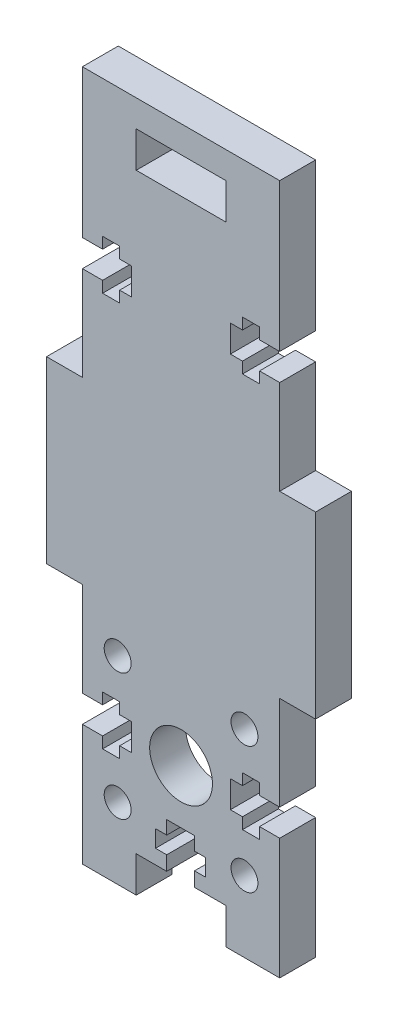
from build123d import *

# Parameters (mm, degrees)
SKETCH1_W                     = 22
SKETCH1_H                     = 74
SKETCH1_R                     = 3.5
SHEET_THICKNESS_DEPTH         = 4
BEARING_START                 = -4
SKETCH2_R                     = 3.5
SKETCH2_R_2                   = 1.5
BEARING_HOLDER_MOUNTING_DEPTH = 4
NUT_MOUNTING_DEPTH            = 4
SKETCH5_W                     = 10
SKETCH5_H                     = 4
TOP_SLOTS_DEPTH               = 4
SKETCH9_W                     = 4
SKETCH9_H                     = 20
BOSS_EXTRUDE3_DEPTH           = 4
SKETCH10_W                    = 4
SKETCH10_H                    = 20
BOSS_EXTRUDE4_DEPTH           = 4
SKETCH11_W                    = 22
SKETCH11_H                    = 4
BOSS_EXTRUDE5_DEPTH           = 3
SKETCH14_W                    = 1.55
SKETCH14_H                    = 1.5
SKETCH14_H_2                  = 1.9
SKETCH14_H_3                  = 1.6
SKETCH14_W_2                  = 1.25
CUT_EXTRUDE4_DEPTH            = 10


with BuildPart() as part:
    # Sketch1 → Sheet Thickness (new body)
    with BuildSketch(Plane.XY):
        with Locations((10, -16)):
            Rectangle(SKETCH1_W, SKETCH1_H)
        with Locations((10, -38)):
            Circle(SKETCH1_R, mode=Mode.SUBTRACT)
    extrude(amount=SHEET_THICKNESS_DEPTH)

    # Sketch2 → Bearing Holder Mounting (cut)
    with BuildSketch(Plane.XY.offset(4).offset(BEARING_START)):
        with Locations((10, -38)):
            Circle(SKETCH2_R)
        with Locations((2.928932188, -30.928932188)):
            Circle(SKETCH2_R_2)
        with Locations((17.071067812, -30.928932188)):
            Circle(SKETCH2_R_2)
        with Locations((17.071067812, -45.071067812)):
            Circle(SKETCH2_R_2)
        with Locations((2.928932188, -45.071067812)):
            Circle(SKETCH2_R_2)
    extrude(amount=BEARING_HOLDER_MOUNTING_DEPTH, mode=Mode.SUBTRACT)

    # Sketch3 → Nut Mounting (cut)
    with BuildSketch(Plane.XY.offset(4)):
        Polygon((1.25, -36.5), (-1, -36.5), (-1, -39.5), (1.25, -39.5), (1.25, -40.75), (3.15, -40.75), (3.15, -39.5), (4.5, -39.5), (4.5, -36.5), (3.15, -36.5), (3.15, -35.25), (1.25, -35.25), align=None)
        Polygon((18.75, -39.5), (21, -39.5), (21, -36.5), (18.75, -36.5), (18.75, -35.25), (16.85, -35.25), (16.85, -36.5), (15.5, -36.5), (15.5, -39.5), (16.85, -39.5), (16.85, -40.75), (18.75, -40.75), align=None)
        Polygon((16.85, 3.25), (18.75, 3.25), (18.75, 4.5), (21, 4.5), (21, 7.5), (18.75, 7.5), (18.75, 8.75), (16.85, 8.75), (16.85, 7.5), (15.5, 7.5), (15.5, 4.5), (16.85, 4.5), align=None)
        Polygon((1.25, 3.25), (3.15, 3.25), (3.15, 4.5), (4.5, 4.5), (4.5, 7.5), (3.15, 7.5), (3.15, 8.75), (1.25, 8.75), (1.25, 7.5), (-1, 7.5), (-1, 4.5), (1.25, 4.5), align=None)
    extrude(amount=-NUT_MOUNTING_DEPTH, mode=Mode.SUBTRACT)

    # Sketch5 → Top Slots (cut)
    with BuildSketch(Plane.XY.offset(4)):
        with Locations((10, -51)):
            Rectangle(SKETCH5_W, SKETCH5_H)
        with Locations((10, 19)):
            Rectangle(SKETCH5_W, SKETCH5_H)
    extrude(amount=-TOP_SLOTS_DEPTH, mode=Mode.SUBTRACT)

    # Sketch9 → Boss-Extrude3 (add)
    with BuildSketch(Plane.ZY.offset(1)):
        with Locations((2, -16)):
            Rectangle(SKETCH9_W, SKETCH9_H)
    extrude(amount=BOSS_EXTRUDE3_DEPTH)

    # Sketch10 → Boss-Extrude4 (add)
    with BuildSketch(Plane(origin=(21, 0, 0), x_dir=(0, 0, -1), z_dir=(1, 0, 0))):
        with Locations((-2, -16)):
            Rectangle(SKETCH10_W, SKETCH10_H)
    extrude(amount=BOSS_EXTRUDE4_DEPTH)

    # Sketch11 → Boss-Extrude5 (add)
    with BuildSketch(Plane(origin=(0, 21, 0), x_dir=(1, 0, 0), z_dir=(0, 1, 0))):
        with Locations((10, -2)):
            Rectangle(SKETCH11_W, SKETCH11_H)
    extrude(amount=BOSS_EXTRUDE5_DEPTH)

    # Sketch14 → Cut-Extrude4 (cut)
    with BuildSketch(Plane.XY.offset(4)):
        with Locations((9.175, -44.75)):
            Rectangle(SKETCH14_W, SKETCH14_H)
        with Locations((10.725, -44.75)):
            Rectangle(SKETCH14_W, SKETCH14_H)
        with Locations((9.175, -46.45)):
            Rectangle(SKETCH14_W, SKETCH14_H_2)
        with Locations((10.725, -46.45)):
            Rectangle(SKETCH14_W, SKETCH14_H_2)
        with Locations((10.725, -48.2)):
            Rectangle(SKETCH14_W, SKETCH14_H_3)
        with Locations((9.175, -48.2)):
            Rectangle(SKETCH14_W, SKETCH14_H_3)
        with Locations((7.775, -46.45)):
            Rectangle(SKETCH14_W_2, SKETCH14_H_2)
        with Locations((12.125, -46.45)):
            Rectangle(SKETCH14_W_2, SKETCH14_H_2)
    extrude(amount=-CUT_EXTRUDE4_DEPTH, mode=Mode.SUBTRACT)


solid = part.part
